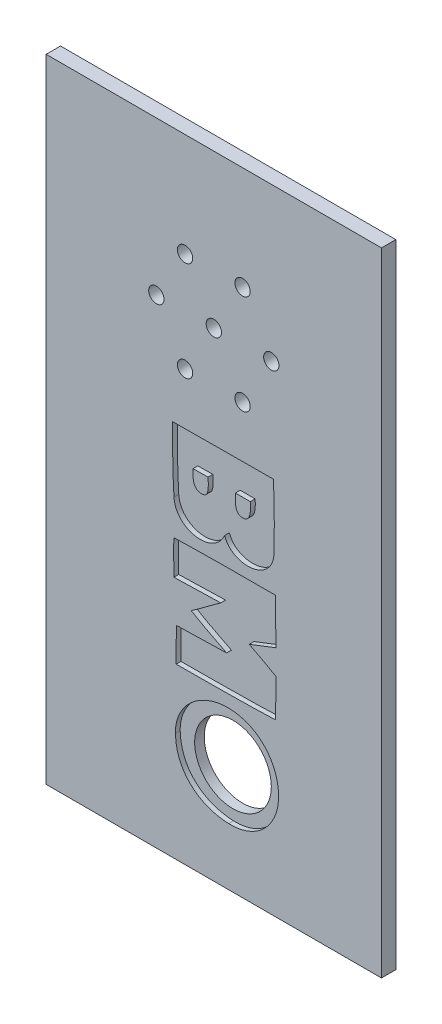
from build123d import *

# Parameters (mm, degrees)
SKETCH1_W           = 70
SKETCH1_H           = 132
BOSS_EXTRUDE1_DEPTH = 3
SKETCH2_R           = 1.6
SKETCH2_R_2         = 8
CUT_EXTRUDE1_DEPTH  = 75.76630257
CUT_EXTRUDE4_DEPTH  = 1


with BuildPart() as part:
    # Sketch1 → Boss-Extrude1 (new body)
    with BuildSketch(Plane.XY):
        Rectangle(SKETCH1_W, SKETCH1_H)
    extrude(amount=BOSS_EXTRUDE1_DEPTH)

    # Sketch2 → Cut-Extrude1 (cut, through all)
    with BuildSketch(Plane.XY.offset(3)):
        with Locations((0, 34)):
            Circle(SKETCH2_R)
        with Locations((12, 34)):
            Circle(SKETCH2_R)
        with Locations((6, 23.607695155)):
            Circle(SKETCH2_R)
        with Locations((-6, 23.607695155)):
            Circle(SKETCH2_R)
        with Locations((-12, 34)):
            Circle(SKETCH2_R)
        with Locations((-6, 44.392304845)):
            Circle(SKETCH2_R)
        with Locations((6, 44.392304845)):
            Circle(SKETCH2_R)
        with Locations((3, -43.897608135)):
            Circle(SKETCH2_R_2)
    extrude(amount=-CUT_EXTRUDE1_DEPTH, mode=Mode.SUBTRACT)

    # Sketch4 → Cut-Extrude4 (cut)
    # profile 1 of 3: a face of its own
    with BuildSketch(Plane.XY.offset(3)):
        with BuildLine():
            Line((12.435373561, 12.906743281), (-8.591322356, 12.79048604))
            add(Edge.make_bspline(
                [(-8.591322356, 12.79048604), (-8.704286114, 8.885776406), (-8.502594221, 1.79384743), (-8.325007333, -0.700797834)],
                knots=[3, 3, 3, 3, 4, 4, 4, 4], degree=3))
            add(Edge.make_bspline(
                [(-8.325007333, -0.700797834), (-7.927810309, -6.293112042), (-0.051557809, -7.493806409), (2.262018013, -2.357422472)],
                knots=[4, 4, 4, 4, 5, 5, 5, 5], degree=3))
            add(Edge.make_bspline(
                [(2.262018013, -2.357422472), (3.647515819, -6.937264415), (12.328667278, -6.654110228), (12.577245481, -0.371389262)],
                knots=[0, 0, 0, 0, 1, 1, 1, 1], degree=3))
            add(Edge.make_bspline(
                [(12.577245481, -0.371389262), (12.657220975, 1.669518266), (12.654067782, 9.68502366), (12.435373561, 12.906743281)],
                knots=[1, 1, 1, 1, 2, 2, 2, 2], degree=3))
        make_face()
        with BuildLine():
            Line((-4.326492155, 6.425883244), (-1.206711683, 6.455631236))
            add(Edge.make_bspline(
                [(-1.206711683, 6.455631236), (-1.074026475, 4.572236089), (-1.015280968, 2.842101206), (-2.419907538, 2.766134029)],
                knots=[1, 1, 1, 1, 2, 2, 2, 2], degree=3))
            add(Edge.make_bspline(
                [(-2.419907538, 2.766134029), (-3.973264085, 2.682447476), (-4.493703991, 3.948173451), (-4.326492155, 6.425883244)],
                knots=[2, 2, 2, 2, 3, 3, 3, 3], degree=3))
        make_face(mode=Mode.SUBTRACT)
        with BuildLine():
            Line((4.521297604, 6.43862815), (7.619481633, 6.437735553))
            add(Edge.make_bspline(
                [(7.619481633, 6.437735553), (7.754881729, 4.557137064), (7.590941128, 2.787865388), (6.186314558, 2.711898211)],
                knots=[1, 1, 1, 1, 2, 2, 2, 2], degree=3))
            add(Edge.make_bspline(
                [(6.186314558, 2.711898211), (4.635672899, 2.631008317), (4.351289109, 3.963633245), (4.521297604, 6.43862815)],
                knots=[2, 2, 2, 2, 3, 3, 3, 3], degree=3))
        make_face(mode=Mode.SUBTRACT)
    # profile 2 of 3: a face of its own
    with BuildSketch(Plane.XY.offset(3)):
        with BuildLine():
            add(Edge.make_bspline(
                [(3.36676789, -33.160113435), (9.417717715, -33.392835626), (13.445086014, -38.057518842), (13.529515019, -43.748190308), (13.613984909, -49.441617546), (9.14299869, -54.262705816), (3.092048865, -54.029983625)],
                knots=[2, 2, 2, 2, 3, 3, 3, 4, 4, 4, 4], degree=3))
            add(Edge.make_bspline(
                [(3.092048865, -54.029983625), (-2.961697619, -53.794546546), (-7.883326898, -49.978313982), (-8.018340697, -43.29333994)],
                knots=[0, 0, 0, 0, 1, 1, 1, 1], degree=3))
            add(Edge.make_bspline(
                [(-8.018340697, -43.29333994), (-8.133164977, -37.597606671), (-2.686937708, -32.927432129), (3.36676789, -33.160113435)],
                knots=[1, 1, 1, 1, 2, 2, 2, 2], degree=3))
        make_face()
    # profile 3 of 3: a face of its own
    with BuildSketch(Plane.XY.offset(3)):
        with BuildLine():
            add(Edge.make_bspline(
                [(-8.315009416, -8.062939687), (-4.406161921, -7.897447705), (8.068102589, -7.822629876), (12.839981265, -7.862087625)],
                knots=[11, 11, 11, 11, 12, 12, 12, 12], degree=3))
            add(Edge.make_bspline(
                [(12.839981265, -7.862087625), (12.861241838, -9.29508964), (12.9589587, -15.881387365), (12.980178387, -17.311633608)],
                knots=[0, 0, 0, 0, 1, 1, 1, 1], degree=3))
            add(Edge.make_bspline(
                [(12.980178387, -17.311633608), (11.763075071, -17.765199017), (8.114684439, -19.13687745), (7.383799305, -19.47848671)],
                knots=[1, 1, 1, 1, 2, 2, 2, 2], degree=3))
            add(Edge.make_bspline(
                [(7.383799305, -19.47848671), (9.108176948, -20.332188301), (12.314465086, -22.045945199), (12.935462432, -22.472239835)],
                knots=[2, 2, 2, 2, 3, 3, 3, 3], degree=3))
            add(Edge.make_bspline(
                [(12.935462432, -22.472239835), (12.97786092, -25.329976547), (12.909725475, -29.283635925), (12.92599799, -30.380433621)],
                knots=[3, 3, 3, 3, 4, 4, 4, 4], degree=3))
            add(Edge.make_bspline(
                [(12.92599799, -30.380433621), (7.795263549, -30.67706556), (-6.389215715, -30.667001608), (-7.858042781, -30.688793695)],
                knots=[4, 4, 4, 4, 5, 5, 5, 5], degree=3))
            add(Edge.make_bspline(
                [(-7.858042781, -30.688793695), (-8.0102064, -28.607228198), (-7.705115353, -24.647296875), (-7.841129113, -23.654261755)],
                knots=[5, 5, 5, 5, 6, 6, 6, 6], degree=3))
            add(Edge.make_bspline(
                [(-7.841129113, -23.654261755), (-4.784976738, -23.608919496), (1.083266322, -23.417113542), (2.673347405, -23.393522483)],
                knots=[6, 6, 6, 6, 7, 7, 7, 7], degree=3))
            add(Edge.make_bspline(
                [(2.673347405, -23.393522483), (-0.775407881, -21.686119301), (-3.737511671, -20.081751157), (-4.722867923, -19.434839155)],
                knots=[7, 7, 7, 7, 8, 8, 8, 8], degree=3))
            add(Edge.make_bspline(
                [(-4.722867923, -19.434839155), (-2.664517487, -18.089507553), (0.355778115, -15.627352279), (1.448315671, -14.952368219)],
                knots=[8, 8, 8, 8, 9, 9, 9, 9], degree=3))
            add(Edge.make_bspline(
                [(1.448315671, -14.952368219), (-3.198997245, -15.134329121), (-7.2306933, -15.194144924), (-8.333002543, -15.21049921)],
                knots=[9, 9, 9, 9, 10, 10, 10, 10], degree=3))
            add(Edge.make_bspline(
                [(-8.333002543, -15.21049921), (-8.355857659, -13.670022044), (-8.425935777, -8.946626939), (-8.315009416, -8.062939687)],
                knots=[10, 10, 10, 10, 11, 11, 11, 11], degree=3))
        make_face()
    extrude(amount=-CUT_EXTRUDE4_DEPTH, mode=Mode.SUBTRACT)


solid = part.part
